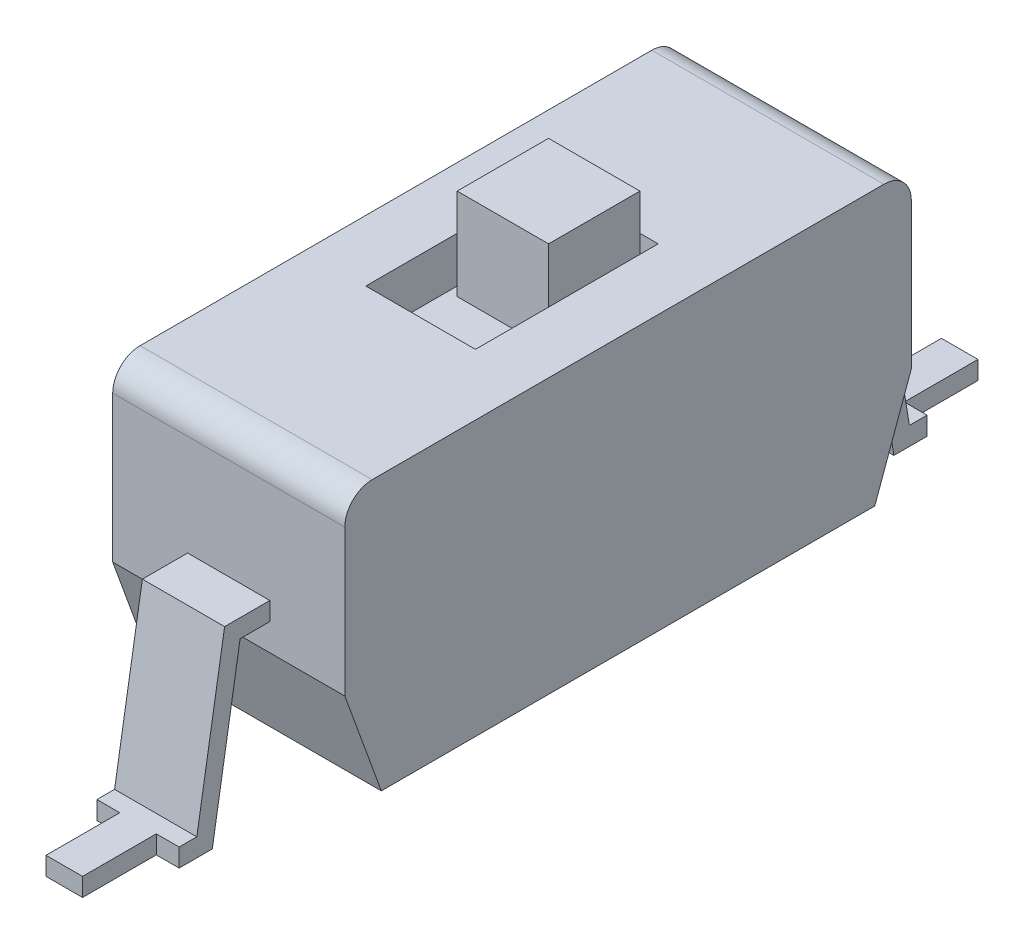
from build123d import *

# Parameters (mm, degrees)
SKETCH_1_W           = 2.54
SKETCH_1_H           = 6.2
EXTRUDE_1_DEPTH      = 3
SKETCH_2_W           = 1.2
SKETCH_2_H           = 2
CUT_EXTRUDE_1_DEPTH  = 0.5
SKETCH_3_W           = 1
SKETCH_3_H           = 1
EXTRUDE_1_2_DEPTH    = 1
FILLET_1_R           = 0.3
CHAMFER_1_SIZE       = 0.4
CHAMFER_1_SIZE2      = 1.098990968
EXTRUDE_2_DEPTH      = 0.45
EXTRUDE_2_DEPTH_BACK = 0.45
SKETCH_5_W           = 0.25
SKETCH_5_H           = 0.807139358
CUT_EXTRUDE_2_DEPTH  = 0.45


with BuildPart() as part:
    # 草图1 → Extrude 1 (new body)
    with BuildSketch(Plane(origin=(0, 0, 0), x_dir=(1, 0, 0), z_dir=(0, 1, 0))):
        Rectangle(SKETCH_1_W, SKETCH_1_H)
    extrude(amount=EXTRUDE_1_DEPTH)

    # 草图2 → 切除-拉伸1 (cut)
    with BuildSketch(Plane(origin=(0, 3, 0), x_dir=(1, 0, 0), z_dir=(0, 1, 0))):
        Rectangle(SKETCH_2_W, SKETCH_2_H)
    extrude(amount=-CUT_EXTRUDE_1_DEPTH, mode=Mode.SUBTRACT)

    # 草图3 → Extrude 1 2 (add)
    with BuildSketch(Plane(origin=(0, 2.5, 0), x_dir=(1, 0, 0), z_dir=(0, 1, 0))):
        with Locations((0, 0.4)):
            Rectangle(SKETCH_3_W, SKETCH_3_H)
    extrude(amount=EXTRUDE_1_2_DEPTH)

    # 圆角1
    fillet_1_edges = [part.edges().sort_by_distance(p)[0] for p in [
        (0, 3, -3.1),
        (0, 3, 3.1),
    ]]
    fillet(fillet_1_edges, radius=FILLET_1_R)

    # 倒角1
    chamfer_1_edges = [part.edges().sort_by_distance(p)[0] for p in [
        (0, 0, -3.1),
        (0, 0, 3.1),
    ]]
    chamfer_1_side = [part.faces().sort_by_distance(p)[0] for p in [
        (0, 0, 0),
    ]]
    chamfer(chamfer_1_edges, length=CHAMFER_1_SIZE, length2=CHAMFER_1_SIZE2, reference=chamfer_1_side[0])

    # 草图4 → 凸台-拉伸2 (add, two sides: drawn at the far end of the back side and taken through both)
    with BuildSketch(Plane(origin=(0, 0, 0), x_dir=(0, 0, -1), z_dir=(1, 0, 0)).offset(-EXTRUDE_2_DEPTH_BACK)):
        Polygon((-2.942106966, 1.594783958), (-3.595340284, 1.594783958), (-3.89950168, -0.245392483), (-4.9, -0.245392483), (-4.9, -0.445392483), (-3.729845887, -0.445392483), (-3.425684492, 1.394783958), (-2.942106966, 1.394783958), align=None)
        Polygon((2.942106966, 1.394783958), (2.942106966, 1.594783958), (3.595340284, 1.594783958), (3.89950168, -0.245392483), (4.9, -0.245392483), (4.9, -0.445392483), (3.729845887, -0.445392483), (3.425684492, 1.394783958), align=None)
    extrude(amount=EXTRUDE_2_DEPTH + EXTRUDE_2_DEPTH_BACK)

    # 草图5 → 切除-拉伸2 (cut)
    with BuildSketch(Plane(origin=(0, -0.245392483, 0), x_dir=(1, 0, 0), z_dir=(0, 1, 0))):
        with Locations((0.325, 4.496430321)):
            Rectangle(SKETCH_5_W, SKETCH_5_H)
        with Locations((-0.325, 4.496430321)):
            Rectangle(SKETCH_5_W, SKETCH_5_H)
        with Locations((0.325, -4.496430321)):
            Rectangle(SKETCH_5_W, SKETCH_5_H)
        with Locations((-0.325, -4.496430321)):
            Rectangle(SKETCH_5_W, SKETCH_5_H)
    extrude(amount=-CUT_EXTRUDE_2_DEPTH, mode=Mode.SUBTRACT)


solid = part.part
